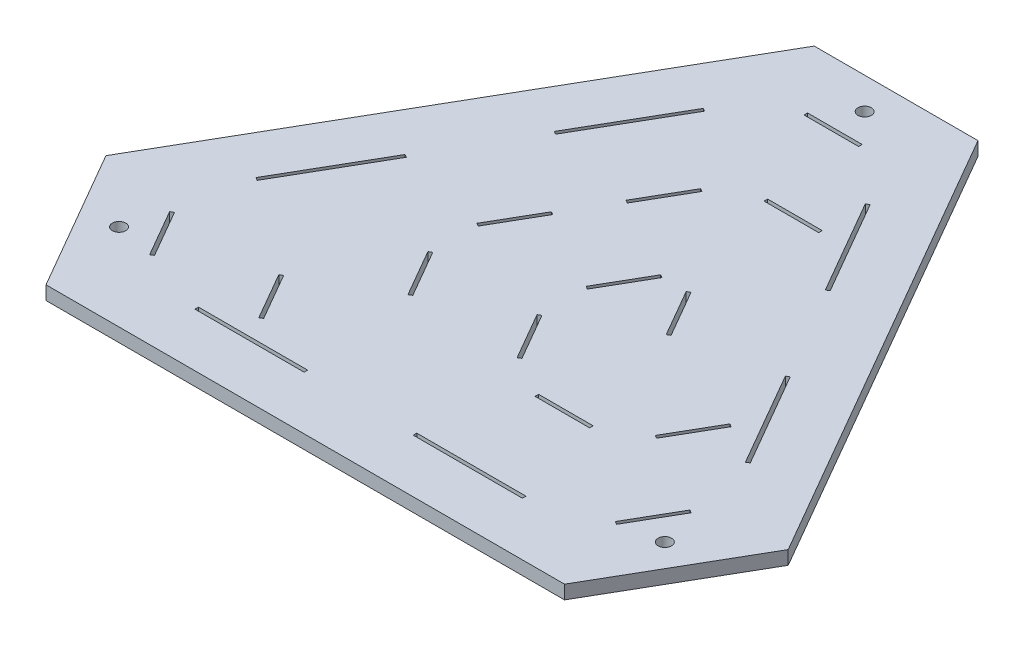
from build123d import *

# Parameters (mm, degrees)
SKETCH1_R           = 4.9022
SKETCH1_W           = 40
SKETCH1_H           = 2.6
SKETCH1_W_2         = 80
BOSS_EXTRUDE4_DEPTH = 10


with BuildPart() as part:
    # Sketch1 → Boss-Extrude4 (new body)
    with BuildSketch(Plane(origin=(0, 0, 0), x_dir=(1, 0, 0), z_dir=(0, 1, 0))):
        Polygon((-60.000001624, 254.034119381), (60.000003913, 254.034119381), (250.000001144, -75.055535655), (189.999998376, -178.978582511), (-190.000001624, -178.978582511), (-250.000001624, -75.055534057), align=None)
        with Locations(Location((-200.000000812, -115.470053369, 0), (0, 0, 270))):
            Circle(SKETCH1_R, mode=Mode.SUBTRACT)
        with Locations(Location((199.99999988, -115.470053769, 0), (0, 0, 270))):
            Circle(SKETCH1_R, mode=Mode.SUBTRACT)
        with Locations(Location((5.72e-07, 230.940108145, 0), (0, 0, 270))):
            Circle(SKETCH1_R, mode=Mode.SUBTRACT)
        Polygon((-191.125833025, -87.252540378), (-188.874166975, -85.952540378), (-168.874166975, -120.59355653), (-171.125833025, -121.89355653), align=None, mode=Mode.SUBTRACT)
        with Locations((0, 207.846096908)):
            Rectangle(SKETCH1_W, SKETCH1_H, mode=Mode.SUBTRACT)
        Polygon((188.874166975, -85.952540378), (191.125833025, -87.252540378), (171.125833025, -121.89355653), (168.874166975, -120.59355653), align=None, mode=Mode.SUBTRACT)
        Polygon((148.874166975, -16.670508076), (151.125833025, -17.970508076), (131.125833025, -52.611524227), (128.874166975, -51.311524227), align=None, mode=Mode.SUBTRACT)
        Polygon((-51.125833025, 52.611524227), (-48.874166975, 51.311524227), (-68.874166975, 16.670508076), (-71.125833025, 17.970508076), align=None, mode=Mode.SUBTRACT)
        Polygon((-11.125833025, 121.89355653), (-8.874166975, 120.59355653), (-28.874166975, 85.952540378), (-31.125833025, 87.252540378), align=None, mode=Mode.SUBTRACT)
        Polygon((28.874166975, 52.611524227), (31.125833025, 51.311524227), (11.125833025, 16.670508076), (8.874166975, 17.970508076), align=None, mode=Mode.SUBTRACT)
        Polygon((-61.125833025, 173.855080757), (-58.874166975, 172.555080757), (-98.874166975, 103.273048454), (-101.125833025, 104.573048454), align=None, mode=Mode.SUBTRACT)
        Polygon((-141.125833025, 35.291016151), (-138.874166975, 33.991016151), (-178.874166975, -35.291016151), (-181.125833025, -33.991016151), align=None, mode=Mode.SUBTRACT)
        with Locations((40, 138.564064606)):
            Rectangle(SKETCH1_W, SKETCH1_H, mode=Mode.SUBTRACT)
        with Locations((80, -69.282032303)):
            Rectangle(SKETCH1_W, SKETCH1_H, mode=Mode.SUBTRACT)
        with Locations((-80, -138.564064606)):
            Rectangle(SKETCH1_W_2, SKETCH1_H, mode=Mode.SUBTRACT)
        with Locations((80, -138.564064606)):
            Rectangle(SKETCH1_W_2, SKETCH1_H, mode=Mode.SUBTRACT)
        Polygon((-111.125833025, -87.252540378), (-108.874166975, -85.952540378), (-88.874166975, -120.59355653), (-91.125833025, -121.89355653), align=None, mode=Mode.SUBTRACT)
        Polygon((-71.125833025, -17.970508076), (-68.874166975, -16.670508076), (-48.874166975, -51.311524227), (-51.125833025, -52.611524227), align=None, mode=Mode.SUBTRACT)
        Polygon((8.874166975, -17.970508076), (11.125833025, -16.670508076), (31.125833025, -51.311524227), (28.874166975, -52.611524227), align=None, mode=Mode.SUBTRACT)
        Polygon((48.874166975, 51.311524227), (51.125833025, 52.611524227), (71.125833025, 17.970508076), (68.874166975, 16.670508076), align=None, mode=Mode.SUBTRACT)
        Polygon((58.863601684, 172.573380377), (61.115267734, 173.873380377), (101.115267734, 104.591348074), (98.863601684, 103.291348074), align=None, mode=Mode.SUBTRACT)
        Polygon((138.874166975, 33.991016151), (141.125833025, 35.291016151), (181.125833025, -33.991016151), (178.874166975, -35.291016151), align=None, mode=Mode.SUBTRACT)
    extrude(amount=BOSS_EXTRUDE4_DEPTH)


solid = part.part
